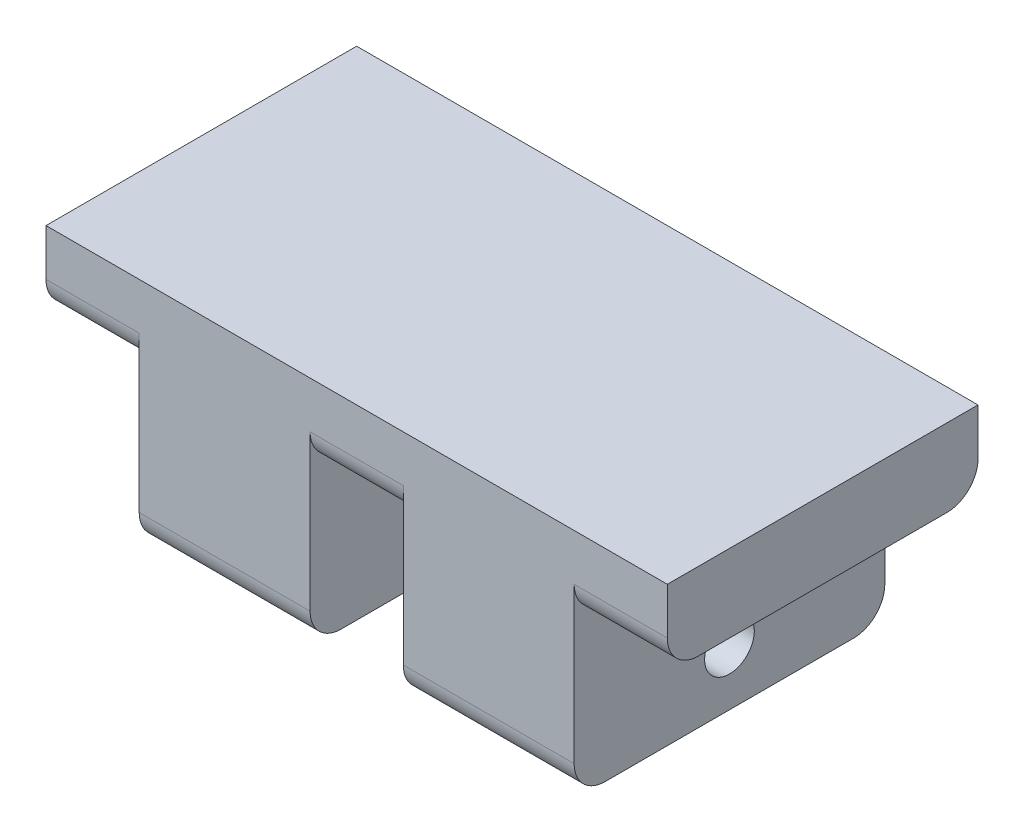
from build123d import *

# Parameters (mm, degrees)
BOSS_EXTRUDE1_DEPTH = 25.4
FILLET1_R           = 2.54
SKETCH2_R           = 2.032
CUT_EXTRUDE1_DEPTH  = 54.596407529
FILLET2_R           = 2.54


with BuildPart() as part:
    # Sketch1 → Boss-Extrude1 (new body)
    with BuildSketch(Plane.XY):
        Polygon((0, 0), (0, 12.7), (-7.62, 12.7), (-7.62, 19.05), (43.18, 19.05), (43.18, 12.7), (35.56, 12.7), (35.56, 0), (21.59, 0), (21.59, 12.7), (13.97, 12.7), (13.97, 0), align=None)
    extrude(amount=BOSS_EXTRUDE1_DEPTH)

    # Fillet1
    fillet1_edges = [part.edges().sort_by_distance(p)[0] for p in [
        (28.575, 0, 0),
        (6.985, 0, 0),
        (28.575, 0, 25.4),
        (6.985, 0, 25.4),
    ]]
    fillet(fillet1_edges, radius=FILLET1_R)

    # Sketch2 → Cut-Extrude1 (cut, through all)
    with BuildSketch(Plane(origin=(35.56, 0, 0), x_dir=(0, 0, -1), z_dir=(1, 0, 0))):
        with Locations((-12.7, 4.572)):
            Circle(SKETCH2_R)
    extrude(amount=-CUT_EXTRUDE1_DEPTH, mode=Mode.SUBTRACT)

    # Fillet2
    fillet2_edges = [part.edges().sort_by_distance(p)[0] for p in [
        (17.78, 12.7, 25.4),
        (-3.81, 12.7, 0),
        (39.37, 12.7, 0),
        (17.78, 12.7, 0),
        (39.37, 12.7, 25.4),
        (-3.81, 12.7, 25.4),
    ]]
    fillet(fillet2_edges, radius=FILLET2_R)


solid = part.part
